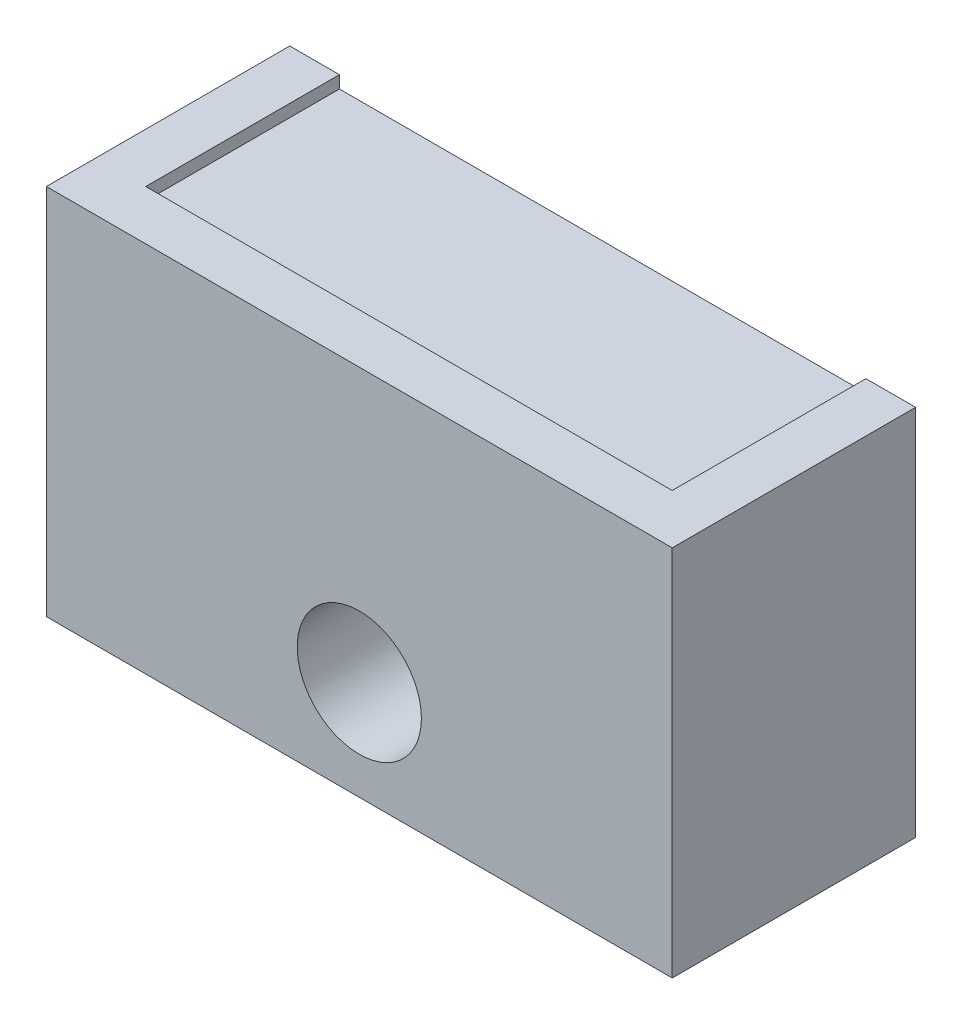
from build123d import *

# Parameters (mm, degrees)
SKETCH2_W           = 25.2
SKETCH2_H           = 15
BOSS_EXTRUDE2_DEPTH = 2
SKETCH3_W           = 21.2
SKETCH3_H           = 2
BOSS_EXTRUDE3_DEPTH = 7.8
SKETCH8_W           = 2.35
SKETCH8_H           = 8.163083502
SKETCH8_W_2         = 6.497887862
BOSS_EXTRUDE6_DEPTH = 7.8
SKETCH9_W           = 5
SKETCH9_H           = 8.163083502
SKETCH9_W_2         = 5.002112138
BOSS_EXTRUDE7_DEPTH = 1.3
SKETCH10_W          = 21.2
SKETCH10_H          = 7.8
CUT_EXTRUDE3_DEPTH  = 0.5
SKETCH12_R          = 1
CUT_EXTRUDE4_DEPTH  = 31.920543333
SKETCH13_R          = 2.5
CUT_EXTRUDE5_DEPTH  = 5.634787343


with BuildPart() as part:
    # Sketch2 → Boss-Extrude2 (new body)
    with BuildSketch(Plane.XY):
        with Locations((-12.6, 7.5)):
            Rectangle(SKETCH2_W, SKETCH2_H)
    extrude(amount=BOSS_EXTRUDE2_DEPTH)

    # Sketch3 → Boss-Extrude3 (add)
    with BuildSketch(Plane(origin=(0, 0, 0), x_dir=(-1, 0, 0), z_dir=(0, 0, -1))):
        Polygon((2, 15), (0, 15), (0, 0), (2, 0), (2, 13), align=None)
        with Locations((12.6, 14)):
            Rectangle(SKETCH3_W, SKETCH3_H)
        Polygon((25.2, 15), (23.2, 15), (23.2, 13), (23.2, 0), (25.2, 0), align=None)
    extrude(amount=BOSS_EXTRUDE3_DEPTH)

    # Sketch8 → Boss-Extrude6 (add)
    with BuildSketch(Plane(origin=(0, 0, 0), x_dir=(-1, 0, 0), z_dir=(0, 0, -1))):
        with Locations((3.175, 4.081541751)):
            Rectangle(SKETCH8_W, SKETCH8_H)
        with Locations((12.598943931, 4.081541751)):
            Rectangle(SKETCH8_W_2, SKETCH8_H)
        with Locations((22.025, 4.081541751)):
            Rectangle(SKETCH8_W, SKETCH8_H)
    extrude(amount=BOSS_EXTRUDE6_DEPTH)

    # Sketch9 → Boss-Extrude7 (add)
    with BuildSketch(Plane(origin=(0, 0, 0), x_dir=(-1, 0, 0), z_dir=(0, 0, -1))):
        with Locations((6.85, 4.081541751)):
            Rectangle(SKETCH9_W, SKETCH9_H)
        with Locations((18.348943931, 4.081541751)):
            Rectangle(SKETCH9_W_2, SKETCH9_H)
    extrude(amount=BOSS_EXTRUDE7_DEPTH)

    # Sketch10 → Cut-Extrude3 (cut)
    with BuildSketch(Plane(origin=(0, 15, 0), x_dir=(1, 0, 0), z_dir=(0, 1, 0))):
        with Locations((-12.6, 3.9)):
            Rectangle(SKETCH10_W, SKETCH10_H)
    extrude(amount=-CUT_EXTRUDE3_DEPTH, mode=Mode.SUBTRACT)

    # Sketch12 → Cut-Extrude4 (cut, through all)
    with BuildSketch(Plane.XY.offset(2)):
        with Locations((-12.6, 4)):
            Circle(SKETCH12_R)
    extrude(amount=-CUT_EXTRUDE4_DEPTH, mode=Mode.SUBTRACT)

    # Sketch13 → Cut-Extrude5 (cut)
    with BuildSketch(Plane.XY.offset(2)):
        with Locations((-12.6, 4)):
            Circle(SKETCH13_R)
    extrude(amount=-CUT_EXTRUDE5_DEPTH, mode=Mode.SUBTRACT)


solid = part.part
